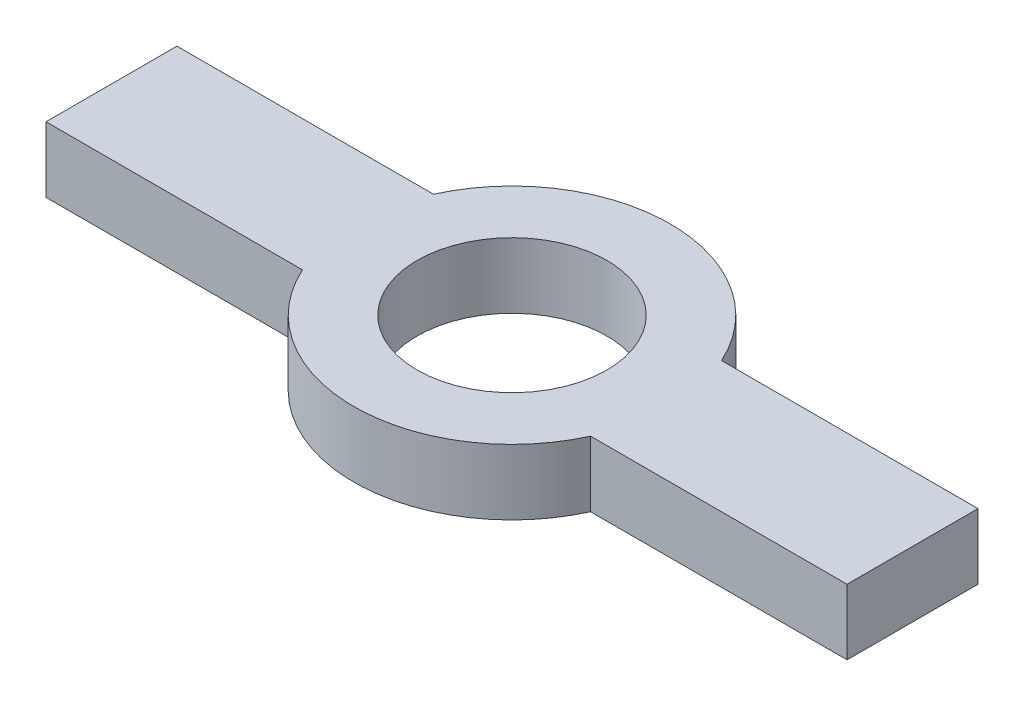
from build123d import *

# Parameters (mm, degrees)
SKETCH1_R           = 7.25
SKETCH1_R_2         = 4.35
BOSS_EXTRUDE1_DEPTH = 3
SKETCH2_W           = 14
SKETCH2_H           = 6
BOSS_EXTRUDE2_DEPTH = 3


with BuildPart() as part:
    # Sketch1 → Boss-Extrude1 (new body)
    with BuildSketch(Plane(origin=(0, 0, 0), x_dir=(1, 0, 0), z_dir=(0, 1, 0))):
        with Locations(Location((0, 0, 0), (0, 0, 270))):
            Circle(SKETCH1_R)
        with Locations(Location((0, 0, 0), (0, 0, 270))):
            Circle(SKETCH1_R_2, mode=Mode.SUBTRACT)
    extrude(amount=BOSS_EXTRUDE1_DEPTH)

    # Sketch2 → Boss-Extrude2 (add)
    with BuildSketch(Plane(origin=(0, 0, 0), x_dir=(1, 0, 0), z_dir=(0, 1, 0))):
        Polygon((4.35, 3), (4.35, 0), (4.35, -3), (18.35, -3), (18.35, 3), align=None)
        with Locations((-11.35, 0)):
            Rectangle(SKETCH2_W, SKETCH2_H)
    extrude(amount=BOSS_EXTRUDE2_DEPTH)


solid = part.part
